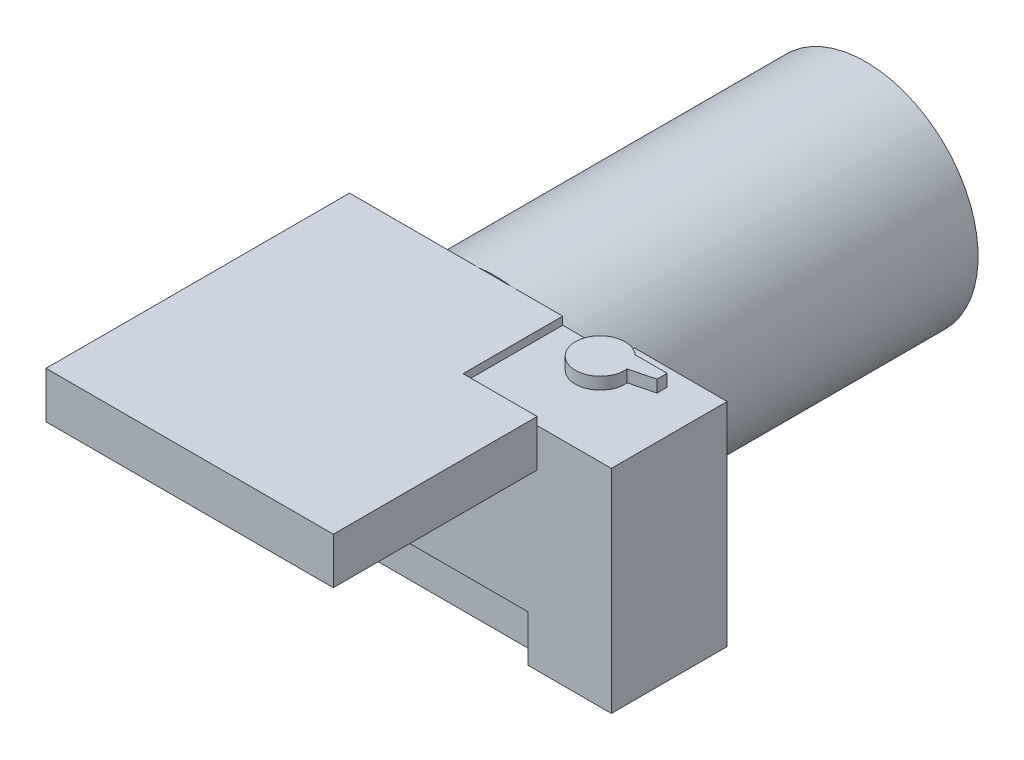
from build123d import *

# Parameters (mm, degrees)
SKETCH1_W           = 99.06
SKETCH1_H           = 27.305
SKETCH1_W_2         = 25.4
SKETCH1_H_2         = 4.445
BOSS_EXTRUDE1_DEPTH = 58.166
SKETCH2_R           = 3.175
CUT_EXTRUDE1_DEPTH  = 25.4
SKETCH3_R           = 30.7975
BOSS_EXTRUDE2_DEPTH = 101.6
SKETCH4_R           = 4.064
BOSS_EXTRUDE3_DEPTH = 2.54
BOSS_EXTRUDE4_DEPTH = 3.302
SKETCH6_W           = 58.42
SKETCH6_H           = 27.305
BOSS_EXTRUDE5_DEPTH = 2.159
SKETCH8_W           = 76.2
SKETCH8_H           = 4.064
CUT_EXTRUDE2_DEPTH  = 12.7
SKETCH9_W           = 78.74
SKETCH9_H           = 55.88
BOSS_EXTRUDE6_DEPTH = 12.7


with BuildPart() as part:
    # Sketch1 → Boss-Extrude1 (new body)
    with BuildSketch(Plane(origin=(0, 0, 0), x_dir=(1, 0, 0), z_dir=(0, 1, 0))):
        with Locations((49.53, 13.6525)):
            Rectangle(SKETCH1_W, SKETCH1_H)
        with Locations((86.36, 29.5275)):
            Rectangle(SKETCH1_W_2, SKETCH1_H_2)
    extrude(amount=BOSS_EXTRUDE1_DEPTH)

    # Sketch2 → Cut-Extrude1 (cut)
    with BuildSketch(Plane.XZ):
        with Locations(Location((39.878, -17.145, 0), (0, 0, 270))):
            Circle(SKETCH2_R)
    extrude(amount=-CUT_EXTRUDE1_DEPTH, mode=Mode.SUBTRACT)

    # Sketch3 → Boss-Extrude2 (add)
    with BuildSketch(Plane(origin=(0, 0, -27.305), x_dir=(-1, 0, 0), z_dir=(0, 0, -1))):
        with Locations(Location((-39.878, 29.845, 0), (0, 0, 113.134129644))):
            Circle(SKETCH3_R)
    extrude(amount=BOSS_EXTRUDE2_DEPTH)

    # Sketch4 → Boss-Extrude3 (add)
    with BuildSketch(Plane(origin=(0, 0, -27.305), x_dir=(-1, 0, 0), z_dir=(0, 0, -1))):
        with Locations((-11.938, 9.525)):
            Circle(SKETCH4_R)
    extrude(amount=BOSS_EXTRUDE3_DEPTH)

    # Sketch5 → Boss-Extrude4 (add)
    with BuildSketch(Plane(origin=(0, 58.166, 0), x_dir=(1, 0, 0), z_dir=(0, 1, 0))):
        with BuildLine():
            ThreePointArc((80.932762025, 22.479), (80.228633257, 24.915474366), (78.680076047, 26.924))
            ThreePointArc((78.680076047, 26.924), (76.342125496, 28.281267167), (73.66, 28.619482732))
            Line((73.66, 28.619482732), (73.66, 27.305))
            Line((73.66, 27.305), (70.125388313, 27.305))
            ThreePointArc((70.125388313, 27.305), (71.11041066, 15.776349905), (80.9625, 21.844))
            ThreePointArc((80.9625, 21.844), (80.955061434, 22.161847977), (80.932762025, 22.479))
        make_face()
        with BuildLine():
            Line((73.66, 27.305), (73.66, 28.619482732))
            ThreePointArc((73.66, 28.619482732), (71.799670865, 28.212378707), (70.125388313, 27.305))
            Line((70.125388313, 27.305), (73.66, 27.305))
        make_face()
        with BuildLine():
            Line((87.4395, 26.924), (78.680076047, 26.924))
            ThreePointArc((78.680076047, 26.924), (80.228633257, 24.915474366), (80.932762025, 22.479))
            Line((80.932762025, 22.479), (87.4395, 24.13))
            Line((87.4395, 24.13), (87.4395, 26.924))
        make_face()
    extrude(amount=BOSS_EXTRUDE4_DEPTH)

    # Sketch6 → Boss-Extrude5 (add)
    with BuildSketch(Plane(origin=(0, 58.166, 0), x_dir=(1, 0, 0), z_dir=(0, 1, 0))):
        with Locations((29.21, 13.6525)):
            Rectangle(SKETCH6_W, SKETCH6_H)
    extrude(amount=BOSS_EXTRUDE5_DEPTH)

    # Sketch8 → Cut-Extrude2 (cut)
    with BuildSketch(Plane.XZ):
        with Locations((38.1, -2.032)):
            Rectangle(SKETCH8_W, SKETCH8_H)
    extrude(amount=-CUT_EXTRUDE2_DEPTH, mode=Mode.SUBTRACT)

    # Sketch9 → Boss-Extrude6 (add)
    with BuildSketch(Plane(origin=(0, 60.325, 0), x_dir=(1, 0, 0), z_dir=(0, 1, 0))):
        with Locations((39.37, -27.94)):
            Rectangle(SKETCH9_W, SKETCH9_H)
    extrude(amount=-BOSS_EXTRUDE6_DEPTH)


solid = part.part
